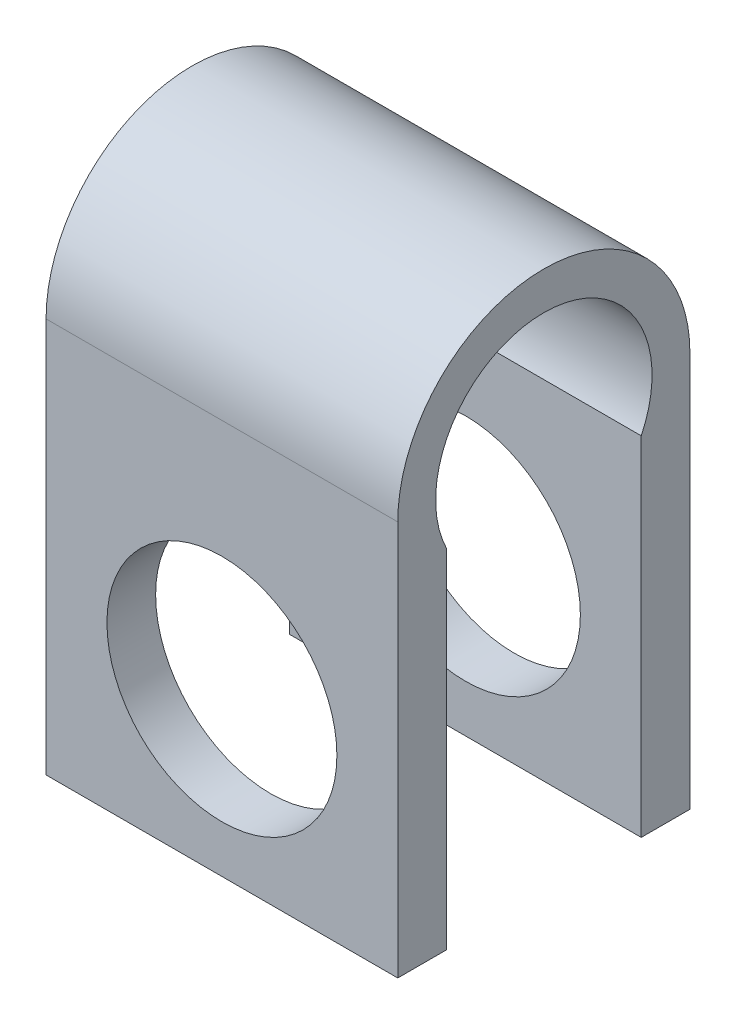
from build123d import *

# Parameters (mm, degrees)
BOSS_EXTRUDE1_DEPTH = 13
SKETCH2_R           = 4.25
CUT_EXTRUDE1_DEPTH  = 23.33383084


with BuildPart() as part:
    # Sketch1 → Boss-Extrude1 (new body)
    with BuildSketch(Plane(origin=(0, 0, 0), x_dir=(0, 0, -1), z_dir=(1, 0, 0))):
        with BuildLine():
            Line((5.4, 0), (5.4, -14.6))
            Line((5.4, -14.6), (3.6, -14.6))
            Line((3.6, -14.6), (3.6, -1.743559577))
            ThreePointArc((3.6, -1.743559577), (0, 4), (-3.6, -1.743559577))
            Line((-3.6, -1.743559577), (-3.6, -14.6))
            Line((-3.6, -14.6), (-5.4, -14.6))
            Line((-5.4, -14.6), (-5.4, 0))
            ThreePointArc((-5.4, 0), (0, 5.4), (5.4, 0))
        make_face()
    extrude(amount=BOSS_EXTRUDE1_DEPTH)

    # Sketch2 → Cut-Extrude1 (cut, through all)
    with BuildSketch(Plane.XY.offset(5.4)):
        with Locations((6.5, -8.6)):
            Circle(SKETCH2_R)
    extrude(amount=-CUT_EXTRUDE1_DEPTH, mode=Mode.SUBTRACT)


solid = part.part
